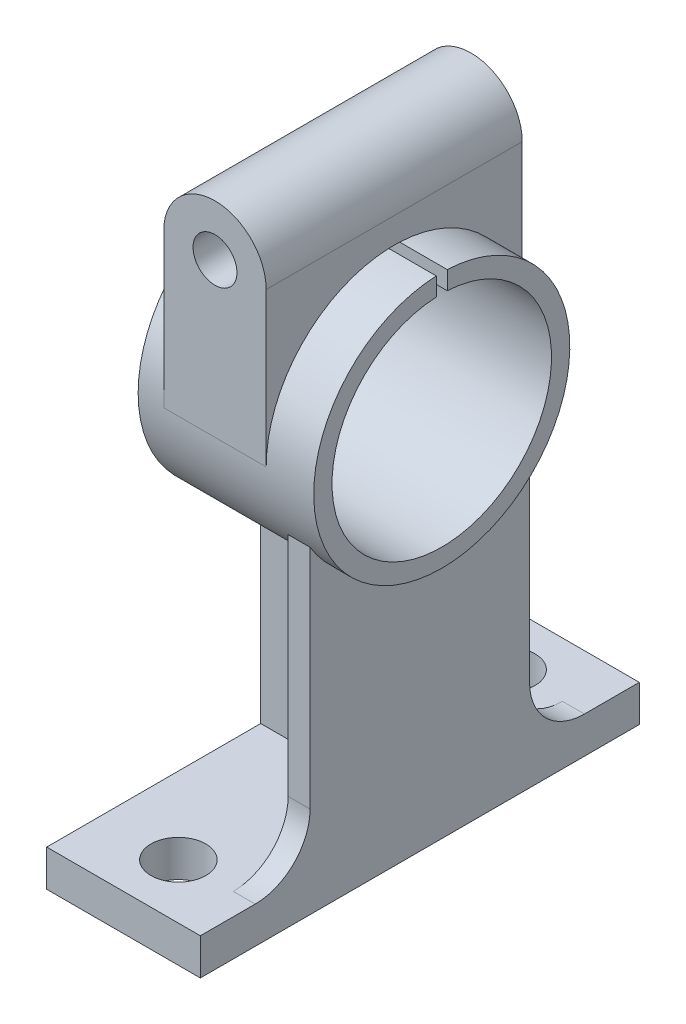
from build123d import *

# Parameters (mm, degrees)
SKETCH1_W                = 42
SKETCH1_H                = 120
SKETCH1_R                = 7.5
BOSS_EXTRUDE1_DEPTH      = 10
BOSS_EXTRUDE2_DEPTH      = 6
BOSS_EXTRUDE3_DEPTH      = 6
BOSS_EXTRUDE3_DEPTH_BACK = 42
BOSS_EXTRUDE4_START      = 36
BOSS_EXTRUDE4_DEPTH      = 36
BOSS_EXTRUDE7_START      = -25
SKETCH5_R                = 6
BOSS_EXTRUDE7_DEPTH      = 70
CUT_EXTRUDE1_START       = -70
CUT_EXTRUDE1_DEPTH       = 70


with BuildPart() as part:
    # Sketch1 → Boss-Extrude1 (new body)
    with BuildSketch(Plane(origin=(0, 0, 0), x_dir=(1, 0, 0), z_dir=(0, 1, 0))):
        with Locations((21, 60)):
            Rectangle(SKETCH1_W, SKETCH1_H)
        with Locations(Location((21, 15, 0), (0, 0, 270))):
            Circle(SKETCH1_R, mode=Mode.SUBTRACT)
        with Locations(Location((21, 105, 0), (0, 0, 90))):
            Circle(SKETCH1_R, mode=Mode.SUBTRACT)
    extrude(amount=BOSS_EXTRUDE1_DEPTH)

    # Sketch2 → Boss-Extrude2 (add)
    with BuildSketch(Plane(origin=(42, 0, 0), x_dir=(0, 0, -1), z_dir=(1, 0, 0))):
        with BuildLine():
            Line((90, 25), (90, 86.972243623))
            ThreePointArc((90, 86.972243623), (60, 70), (30, 86.972243623))
            Line((30, 86.972243623), (30, 25))
            ThreePointArc((30, 25), (25.606601718, 14.393398282), (15, 10))
            Line((15, 10), (105, 10))
            ThreePointArc((105, 10), (94.393398282, 14.393398282), (90, 25))
        make_face()
    extrude(amount=-BOSS_EXTRUDE2_DEPTH)

    # Sketch3 → Boss-Extrude3 (add, two sides: drawn at the far end of the back side and taken through both)
    with BuildSketch(Plane(origin=(42, 0, 0), x_dir=(0, 0, -1), z_dir=(1, 0, 0)).offset(-BOSS_EXTRUDE3_DEPTH_BACK)):
        with BuildLine():
            Line((61.5, 134.962476533), (61.5, 139.96784237))
            ThreePointArc((61.5, 139.96784237), (60, 70), (58.5, 139.96784237))
            Line((58.5, 139.96784237), (58.5, 134.962476533))
            ThreePointArc((58.5, 134.962476533), (60, 75), (61.5, 134.962476533))
        make_face()
    extrude(amount=BOSS_EXTRUDE3_DEPTH + BOSS_EXTRUDE3_DEPTH_BACK)

    # Sketch4 → Boss-Extrude4 (add)
    with BuildSketch(Plane.ZY.offset(-36).offset(BOSS_EXTRUDE4_START)):
        with BuildLine():
            Line((-61.5, 10), (-58.5, 10))
            Line((-58.5, 10), (-58.5, 70.03215763))
            ThreePointArc((-58.5, 70.03215763), (-60, 70), (-61.5, 70.03215763))
            Line((-61.5, 70.03215763), (-61.5, 10))
        make_face()
    extrude(amount=-BOSS_EXTRUDE4_DEPTH)

    # Sketch5 → Boss-Extrude7 (add)
    with BuildSketch(Plane.XY.offset(BOSS_EXTRUDE7_START)):
        with BuildLine():
            Line((7, 105), (35, 105))
            Line((35, 105), (35, 147))
            ThreePointArc((35, 147), (21, 161), (7, 147))
            Line((7, 147), (7, 105))
        make_face()
        with Locations((21, 147)):
            Circle(SKETCH5_R, mode=Mode.SUBTRACT)
    extrude(amount=-BOSS_EXTRUDE7_DEPTH)

    # Sketch6 → Cut-Extrude1 (cut)
    with BuildSketch(Plane(origin=(48, 0, 0), x_dir=(0, 0, -1), z_dir=(1, 0, 0)).offset(CUT_EXTRUDE1_START)):
        with BuildLine():
            Line((58.5, 139.96784237), (58.5, 134.962476533))
            ThreePointArc((58.5, 134.962476533), (60, 75), (61.5, 134.962476533))
            Line((61.5, 134.962476533), (61.5, 139.96784237))
            ThreePointArc((61.5, 139.96784237), (60, 140), (58.5, 139.96784237))
        make_face()
    extrude(amount=CUT_EXTRUDE1_DEPTH, mode=Mode.SUBTRACT)


solid = part.part
